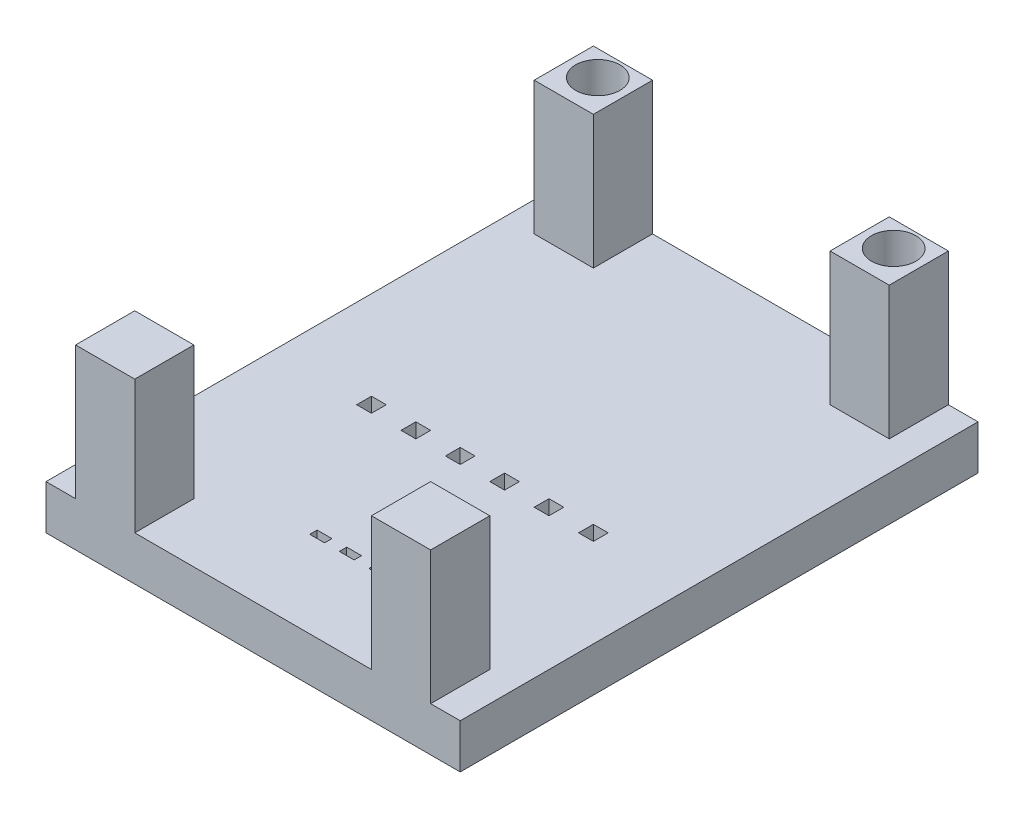
from build123d import *

# Parameters (mm, degrees)
ESQUISSE1_W        = 1
ESQUISSE1_H        = 0.5
ESQUISSE1_H_2      = 1
BOSS_EXTRU_2_DEPTH = 3
ESQUISSE1_4_W      = 4
ESQUISSE1_4_H      = 4
ESQUISSE1_4_R      = 1.5
BOSS_EXTRU_3_DEPTH = 12


with BuildPart() as part:
    # Esquisse1 → Boss.-Extru.2 (new body)
    with BuildSketch(Plane(origin=(0, 0, 0), x_dir=(1, 0, 0), z_dir=(0, 1, 0))):
        Polygon((2, 0), (0, 0), (0, -35), (2, -35), (2, -31), (6, -31), (6, -35), (22, -35), (22, -31), (26, -31), (26, -35), (28, -35), (28, 0), (26, 0), (26, -4), (22, -4), (22, 0), (6, 0), (6, -4), (2, -4), align=None)
        with Locations((12.5, -28.922446553)):
            Rectangle(ESQUISSE1_W, ESQUISSE1_H, mode=Mode.SUBTRACT)
        with Locations((6.5, -19.5)):
            Rectangle(ESQUISSE1_W, ESQUISSE1_H_2, mode=Mode.SUBTRACT)
        with Locations((9.5, -19.5)):
            Rectangle(ESQUISSE1_W, ESQUISSE1_H_2, mode=Mode.SUBTRACT)
        with Locations((12.5, -19.5)):
            Rectangle(ESQUISSE1_W, ESQUISSE1_H_2, mode=Mode.SUBTRACT)
        with Locations((14.5, -28.922446553)):
            Rectangle(ESQUISSE1_W, ESQUISSE1_H, mode=Mode.SUBTRACT)
        with Locations((16.5, -28.922446553)):
            Rectangle(ESQUISSE1_W, ESQUISSE1_H, mode=Mode.SUBTRACT)
        with Locations((15.5, -19.5)):
            Rectangle(ESQUISSE1_W, ESQUISSE1_H_2, mode=Mode.SUBTRACT)
        with Locations((18.5, -19.5)):
            Rectangle(ESQUISSE1_W, ESQUISSE1_H_2, mode=Mode.SUBTRACT)
        with Locations((21.5, -19.5)):
            Rectangle(ESQUISSE1_W, ESQUISSE1_H_2, mode=Mode.SUBTRACT)
    extrude(amount=BOSS_EXTRU_2_DEPTH)

    # Esquisse1<4> → Boss.-Extru.3 (add)
    # profile 1 of 4: a face of its own
    with BuildSketch(Plane(origin=(0, 0, 0), x_dir=(1, 0, 0), z_dir=(0, 1, 0))):
        with Locations((4, -2)):
            Rectangle(ESQUISSE1_4_W, ESQUISSE1_4_H)
        with Locations((4, -1.7)):
            Circle(ESQUISSE1_4_R, mode=Mode.SUBTRACT)
    # profile 2 of 4: a face of its own
    with BuildSketch(Plane(origin=(0, 0, 0), x_dir=(1, 0, 0), z_dir=(0, 1, 0))):
        with Locations((4, -33)):
            Rectangle(ESQUISSE1_4_W, ESQUISSE1_4_H)
    # profile 3 of 4: a face of its own
    with BuildSketch(Plane(origin=(0, 0, 0), x_dir=(1, 0, 0), z_dir=(0, 1, 0))):
        with Locations((24, -2)):
            Rectangle(ESQUISSE1_4_W, ESQUISSE1_4_H)
        with Locations((24, -1.7)):
            Circle(ESQUISSE1_4_R, mode=Mode.SUBTRACT)
    # profile 4 of 4: a face of its own
    with BuildSketch(Plane(origin=(0, 0, 0), x_dir=(1, 0, 0), z_dir=(0, 1, 0))):
        with Locations((24, -33)):
            Rectangle(ESQUISSE1_4_W, ESQUISSE1_4_H)
    extrude(amount=BOSS_EXTRU_3_DEPTH)


solid = part.part
